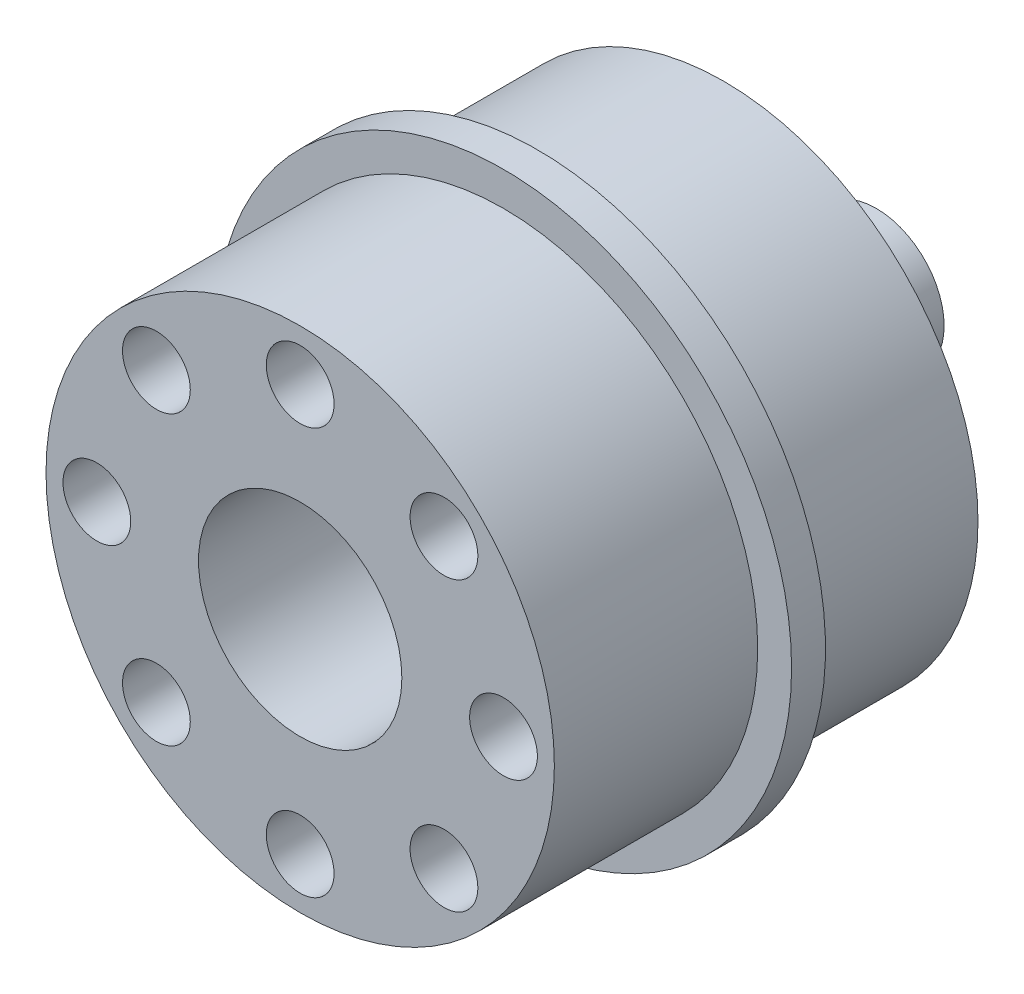
from build123d import *

# Parameters (mm, degrees)
SKETCH_1_R                    = 17
EXTRUDE_1_DEPTH               = 25
SKETCH_3_R                    = 4
EXTRUDE_3_DEPTH               = 9
SKETCH_4_R                    = 17
SKETCH_4_R_2                  = 15
CUT_EXTRUDE_1_DEPTH           = 11
CUT_EXTRUDE_START             = -12
SKETCH_5_R                    = 17
SKETCH_5_R_2                  = 15
CUT_EXTRUDE_2_DEPTH           = 12
HOLE_WIZARD_M4_1_D            = 3.3
HOLE_WIZARD_M4_1_DEPTH        = 10.1
HOLE_WIZARD_M4_1_CBORE_D      = 4
HOLE_WIZARD_M4_1_CBORE_DEPTH  = 8
HOLE_WIZARD_M4_1_TIP          = 0.991420021
CUT_EXTRUDE_3_DEPTH           = 10
CUT_EXTRUDE_3_DEPTH_BACK      = 10
SKETCH_9_R                    = 1.7
HOLE_WIZARD_M12_1_D           = 10.2
HOLE_WIZARD_M12_1_DEPTH       = 19.25
HOLE_WIZARD_M12_1_CBORE_D     = 12
HOLE_WIZARD_M12_1_CBORE_DEPTH = 14
HOLE_WIZARD_M12_1_TIP         = 3.064389157


with BuildPart() as part:
    # 草图1 → 拉伸1 (new body)
    with BuildSketch(Plane.XY):
        Circle(SKETCH_1_R)
    extrude(amount=EXTRUDE_1_DEPTH)

    # 草图3 → 拉伸3 (add)
    with BuildSketch(Plane(origin=(0, 0, 0), x_dir=(-1, 0, 0), z_dir=(0, 0, -1))):
        Circle(SKETCH_3_R)
    extrude(amount=EXTRUDE_3_DEPTH)

    # 草图4 → 切除-拉伸1 (cut)
    with BuildSketch(Plane(origin=(0, 0, 0), x_dir=(-1, 0, 0), z_dir=(0, 0, -1))):
        Circle(SKETCH_4_R)
        Circle(SKETCH_4_R_2, mode=Mode.SUBTRACT)
    extrude(amount=-CUT_EXTRUDE_1_DEPTH, mode=Mode.SUBTRACT)

    # 草图5 → 切除-拉伸2 (cut)
    with BuildSketch(Plane.XY.offset(25).offset(CUT_EXTRUDE_START)):
        Circle(SKETCH_5_R)
        Circle(SKETCH_5_R_2, mode=Mode.SUBTRACT)
    extrude(amount=CUT_EXTRUDE_2_DEPTH, mode=Mode.SUBTRACT)

    # M4 螺纹孔1
    with Locations(Plane(origin=(-12, 0, 25), x_dir=(1, 0, 0), z_dir=(0, 0, 1))):
        with Locations((0, 0), (3.514718626, 8.485281374), (12, 12), (20.485281374, 8.485281374), (24, 0), (20.485281374, -8.485281374), (3.514718626, -8.485281374), (12, -12)):
            CounterBoreHole(HOLE_WIZARD_M4_1_D / 2, HOLE_WIZARD_M4_1_CBORE_D / 2, HOLE_WIZARD_M4_1_CBORE_DEPTH, depth=HOLE_WIZARD_M4_1_DEPTH)
            with Locations((0, 0, -(HOLE_WIZARD_M4_1_DEPTH + HOLE_WIZARD_M4_1_TIP / 2))):  # 118° drill point
                Cone(0, HOLE_WIZARD_M4_1_D / 2, HOLE_WIZARD_M4_1_TIP, mode=Mode.SUBTRACT)

    # 草图9 → 切除-拉伸3 (cut, two sides: drawn at the far end of the back side and taken through both)
    with BuildSketch(Plane(origin=(0, 0, 0), x_dir=(1, 0, 0), z_dir=(0, 1, 0)).offset(-CUT_EXTRUDE_3_DEPTH_BACK)):
        with Locations((0, 5)):
            Circle(SKETCH_9_R)
    extrude(amount=CUT_EXTRUDE_3_DEPTH + CUT_EXTRUDE_3_DEPTH_BACK, mode=Mode.SUBTRACT)

    # M12 螺纹孔1
    with Locations(Plane.XY.offset(25)):
        with Locations((0, 0)):
            CounterBoreHole(HOLE_WIZARD_M12_1_D / 2, HOLE_WIZARD_M12_1_CBORE_D / 2, HOLE_WIZARD_M12_1_CBORE_DEPTH, depth=HOLE_WIZARD_M12_1_DEPTH)
            with Locations((0, 0, -(HOLE_WIZARD_M12_1_DEPTH + HOLE_WIZARD_M12_1_TIP / 2))):  # 118° drill point
                Cone(0, HOLE_WIZARD_M12_1_D / 2, HOLE_WIZARD_M12_1_TIP, mode=Mode.SUBTRACT)


solid = part.part
